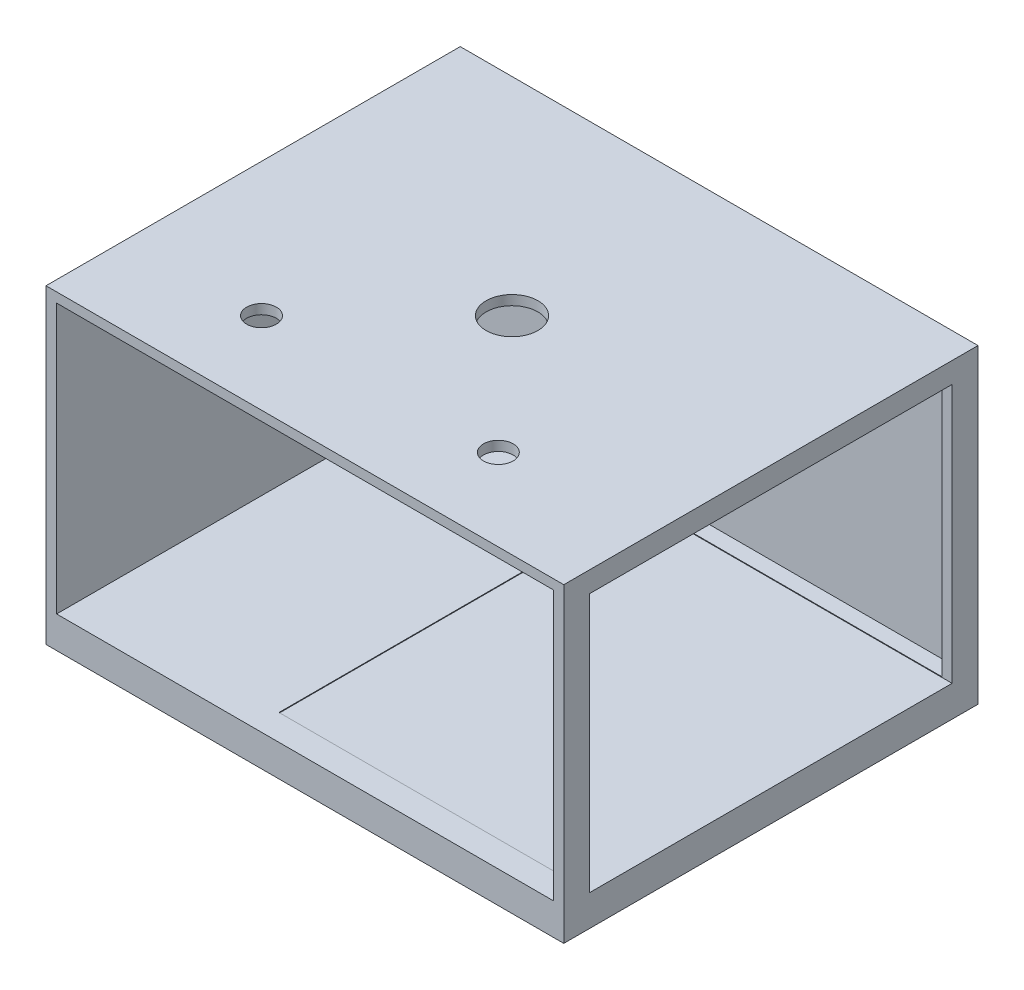
from build123d import *

# Parameters (mm, degrees)
SKETCH1_W           = 500
SKETCH1_H           = 400
BOSS_EXTRUDE1_DEPTH = 300
SKETCH2_W           = 480
SKETCH2_H           = 260
CUT_EXTRUDE1_DEPTH  = 390
SKETCH3_W           = 350
SKETCH3_H           = 250
CUT_EXTRUDE2_DEPTH  = 300
SKETCH4_R           = 25
CUT_EXTRUDE3_DEPTH  = 210
SKETCH5_R           = 14.330272477
CUT_EXTRUDE4_DEPTH  = 210


with BuildPart() as part:
    # Sketch1 → Boss-Extrude1 (new body)
    with BuildSketch(Plane(origin=(0, 0, 0), x_dir=(1, 0, 0), z_dir=(0, 1, 0))):
        Rectangle(SKETCH1_W, SKETCH1_H)
    extrude(amount=BOSS_EXTRUDE1_DEPTH)

    # Sketch2 → Cut-Extrude1 (cut)
    with BuildSketch(Plane.XY.offset(200)):
        with Locations((0.261055225, 160.632083078)):
            Rectangle(SKETCH2_W, SKETCH2_H)
    extrude(amount=-CUT_EXTRUDE1_DEPTH, mode=Mode.SUBTRACT)

    # Sketch3 → Cut-Extrude2 (cut)
    with BuildSketch(Plane(origin=(250, 0, 0), x_dir=(0, 0, -1), z_dir=(1, 0, 0))):
        with Locations((0, 155)):
            Rectangle(SKETCH3_W, SKETCH3_H)
    extrude(amount=-CUT_EXTRUDE2_DEPTH, mode=Mode.SUBTRACT)

    # Sketch4 → Cut-Extrude3 (cut)
    with BuildSketch(Plane(origin=(0, 300, 0), x_dir=(1, 0, 0), z_dir=(0, 1, 0))):
        with Locations(Location((0, 0, 0), (0, 0, 270))):
            Circle(SKETCH4_R)
    extrude(amount=-CUT_EXTRUDE3_DEPTH, mode=Mode.SUBTRACT)

    # Sketch5 → Cut-Extrude4 (cut)
    with BuildSketch(Plane(origin=(0, 300, 0), x_dir=(1, 0, 0), z_dir=(0, 1, 0))):
        with Locations(Location((-120.947499703, -120.947499703, 0), (0, 0, 270))):
            Circle(SKETCH5_R)
        with Locations(Location((107.763649025, -120.947499703, 0), (0, 0, 270))):
            Circle(SKETCH5_R)
    extrude(amount=-CUT_EXTRUDE4_DEPTH, mode=Mode.SUBTRACT)


solid = part.part
